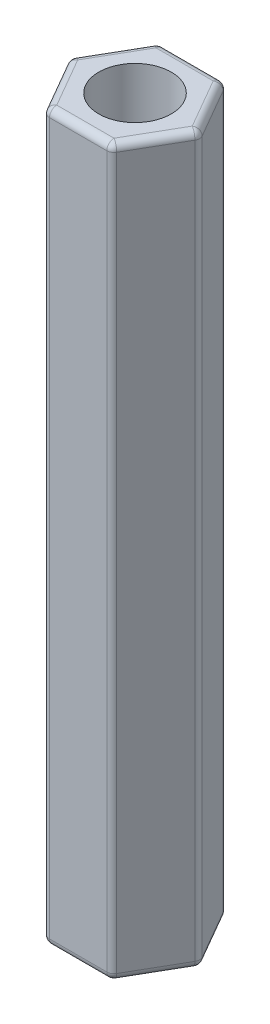
from build123d import *

# Parameters (mm, degrees)
SKETCH_1_R      = 1.5
EXTRUDE_1_DEPTH = 30
FILLET_1_R      = 0.3


with BuildPart() as part:
    # 草图1 → 凸台-拉伸1 (new body)
    with BuildSketch(Plane(origin=(0, 0, 0), x_dir=(1, 0, 0), z_dir=(0, 1, 0))):
        Polygon((2.713546265, 0), (1.356773133, 2.35), (-1.356773133, 2.35), (-2.713546265, 0), (-1.356773133, -2.35), (1.356773133, -2.35), align=None)
        with Locations(Location((0, 0, 0), (0, 0, 270))):
            Circle(SKETCH_1_R, mode=Mode.SUBTRACT)
    extrude(amount=EXTRUDE_1_DEPTH)

    # 圆角1
    fillet_1_edges = [part.edges().sort_by_distance(p)[0] for p in [
        (0, 30, -2.35),
        (1.356773133, 15, 2.35),
        (-1.356773133, 15, 2.35),
        (-2.713546265, 15, 0),
        (-1.356773133, 15, -2.35),
        (1.356773133, 15, -2.35),
        (2.713546265, 15, 0),
        (-2.035159699, 30, -1.175),
        (-2.035159699, 30, 1.175),
        (0, 30, 2.35),
        (2.035159699, 30, 1.175),
        (0, 0, 2.35),
        (-2.035159699, 0, 1.175),
        (-2.035159699, 0, -1.175),
        (2.035159699, 30, -1.175),
        (0, 0, -2.35),
        (2.035159699, 0, -1.175),
        (2.035159699, 0, 1.175),
    ]]
    fillet(fillet_1_edges, radius=FILLET_1_R)


solid = part.part
